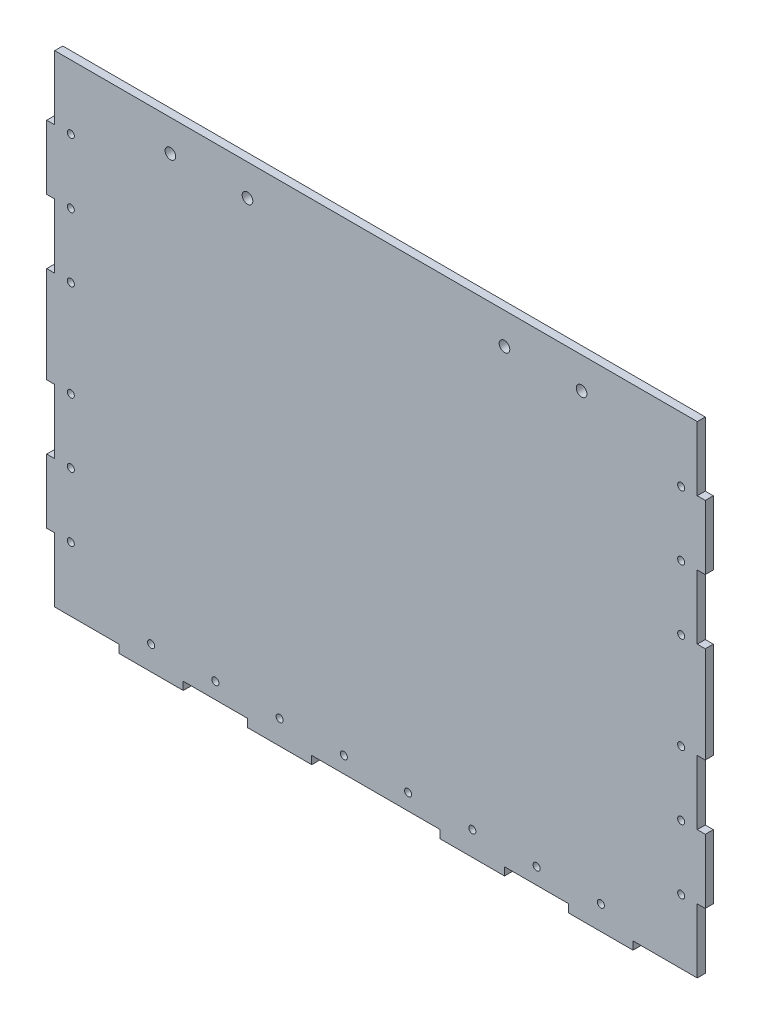
from build123d import *

# Parameters (mm, degrees)
SKETCH_1_R          = 2.2
EXTRUDE_1_DEPTH     = 5
SKETCH_2_R          = 3.3
CUT_EXTRUDE_1_DEPTH = 10


with BuildPart() as part:
    # 草图1 → 凸台-拉伸1 (new body)
    with BuildSketch(Plane.XY):
        Polygon((-200, 150), (200, 150), (200, 110), (205, 110), (205, 70), (200, 70), (200, 30), (205, 30), (205, -30), (200, -30), (200, -70), (205, -70), (205, -110), (200, -110), (200, -150), (160, -150), (160, -155), (120, -155), (120, -150), (80, -150), (80, -155), (40, -155), (40, -150), (-40, -150), (-40, -155), (-80, -155), (-80, -150), (-120, -150), (-120, -155), (-160, -155), (-160, -150), (-200, -150), (-200, -110), (-205, -110), (-205, -70), (-200, -70), (-200, -30), (-205, -30), (-205, 30), (-200, 30), (-200, 70), (-205, 70), (-205, 110), (-200, 110), align=None)
        with Locations((-140, -140)):
            Circle(SKETCH_1_R, mode=Mode.SUBTRACT)
        with Locations((-100, -140)):
            Circle(SKETCH_1_R, mode=Mode.SUBTRACT)
        with Locations((-60, -140)):
            Circle(SKETCH_1_R, mode=Mode.SUBTRACT)
        with Locations((-20, -140)):
            Circle(SKETCH_1_R, mode=Mode.SUBTRACT)
        with Locations((20, -140)):
            Circle(SKETCH_1_R, mode=Mode.SUBTRACT)
        with Locations((60, -140)):
            Circle(SKETCH_1_R, mode=Mode.SUBTRACT)
        with Locations((100, -140)):
            Circle(SKETCH_1_R, mode=Mode.SUBTRACT)
        with Locations((140, -140)):
            Circle(SKETCH_1_R, mode=Mode.SUBTRACT)
        with Locations((-190, 110)):
            Circle(SKETCH_1_R, mode=Mode.SUBTRACT)
        with Locations((-190, 70)):
            Circle(SKETCH_1_R, mode=Mode.SUBTRACT)
        with Locations((-190, 30)):
            Circle(SKETCH_1_R, mode=Mode.SUBTRACT)
        with Locations((-190, -30)):
            Circle(SKETCH_1_R, mode=Mode.SUBTRACT)
        with Locations((-190, -70)):
            Circle(SKETCH_1_R, mode=Mode.SUBTRACT)
        with Locations((-190, -110)):
            Circle(SKETCH_1_R, mode=Mode.SUBTRACT)
        with Locations((190, -110)):
            Circle(SKETCH_1_R, mode=Mode.SUBTRACT)
        with Locations((190, -70)):
            Circle(SKETCH_1_R, mode=Mode.SUBTRACT)
        with Locations((190, -30)):
            Circle(SKETCH_1_R, mode=Mode.SUBTRACT)
        with Locations((190, 30)):
            Circle(SKETCH_1_R, mode=Mode.SUBTRACT)
        with Locations((190, 70)):
            Circle(SKETCH_1_R, mode=Mode.SUBTRACT)
        with Locations((190, 110)):
            Circle(SKETCH_1_R, mode=Mode.SUBTRACT)
    extrude(amount=EXTRUDE_1_DEPTH)

    # 草图2 → 切除-拉伸1 (cut)
    with BuildSketch(Plane.XY.offset(5)):
        with Locations((-80, 130.5)):
            Circle(SKETCH_2_R)
        with Locations((-128, 130.5)):
            Circle(SKETCH_2_R)
        with Locations((128, 130.5)):
            Circle(SKETCH_2_R)
        with Locations((80, 130.5)):
            Circle(SKETCH_2_R)
    extrude(amount=-CUT_EXTRUDE_1_DEPTH, mode=Mode.SUBTRACT)


solid = part.part
